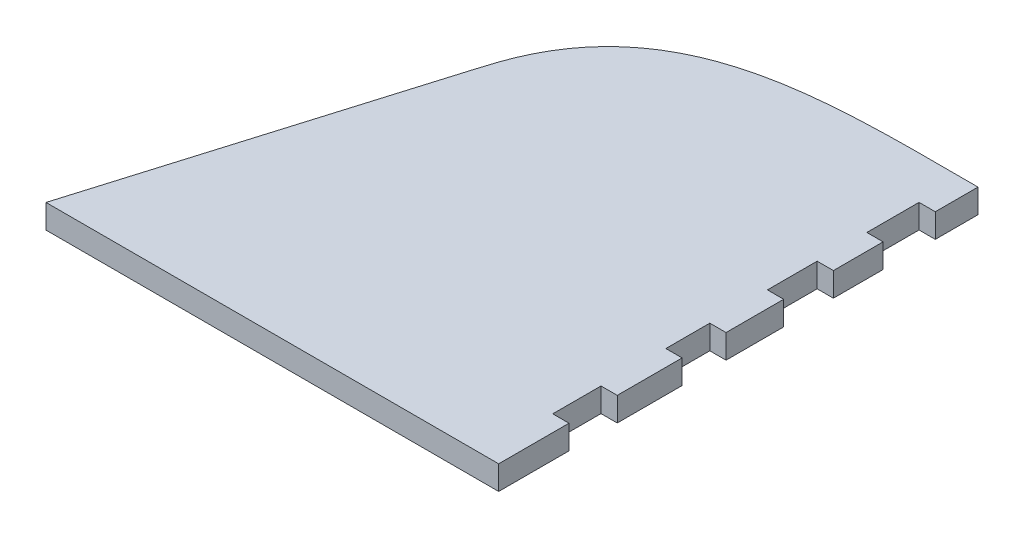
from build123d import *

# Parameters (mm, degrees)
BOSS_EXTRUDE1_DEPTH = 5.715


with BuildPart() as part:
    # Sketch1 → Boss-Extrude1 (new body)
    with BuildSketch(Plane(origin=(0, 0, 0), x_dir=(1, 0, 0), z_dir=(0, 1, 0))):
        with BuildLine():
            Line((23.434979066, 78.109868229), (0, 0))
            Line((0, 0), (107.95, 0))
            Line((107.95, 0), (107.95, 16.763624127))
            Line((107.95, 16.763624127), (104.075854958, 16.763624127))
            Line((104.075854958, 16.763624127), (104.075854958, 28.274535242))
            Line((104.075854958, 28.274535242), (107.95, 28.274535242))
            Line((107.95, 28.274535242), (107.95, 43.736953157))
            Line((107.95, 43.736953157), (104.075854958, 43.736953157))
            Line((104.075854958, 43.736953157), (104.075854958, 54.217036411))
            Line((104.075854958, 54.217036411), (107.95, 54.217036411))
            Line((107.95, 54.217036411), (107.95, 67.961407891))
            Line((107.95, 67.961407891), (104.075854958, 67.961407891))
            Line((104.075854958, 67.961407891), (104.075854958, 79.815928293))
            Line((104.075854958, 79.815928293), (107.95, 79.815928293))
            Line((107.95, 79.815928293), (107.95, 91.670448695))
            Line((107.95, 91.670448695), (104.075854958, 91.670448695))
            Line((104.075854958, 91.670448695), (104.075854958, 104.11377721))
            Line((104.075854958, 104.11377721), (107.95, 104.11377721))
            Line((107.95, 104.11377721), (107.95, 114.3))
            Line((107.95, 114.3), (92.782636258, 114.3))
            add(Edge.make_bspline(
                [(23.434979066, 78.109868229), (23.977674271, 79.918696425), (33.365084494, 111.207368521), (62.592771748, 114.091936467), (92.782636258, 114.3)],
                knots=[0, 0, 0, 0, 0.05, 0.864887892, 0.864887892, 0.864887892, 0.864887892], degree=3))
        make_face()
    extrude(amount=BOSS_EXTRUDE1_DEPTH)


solid = part.part
